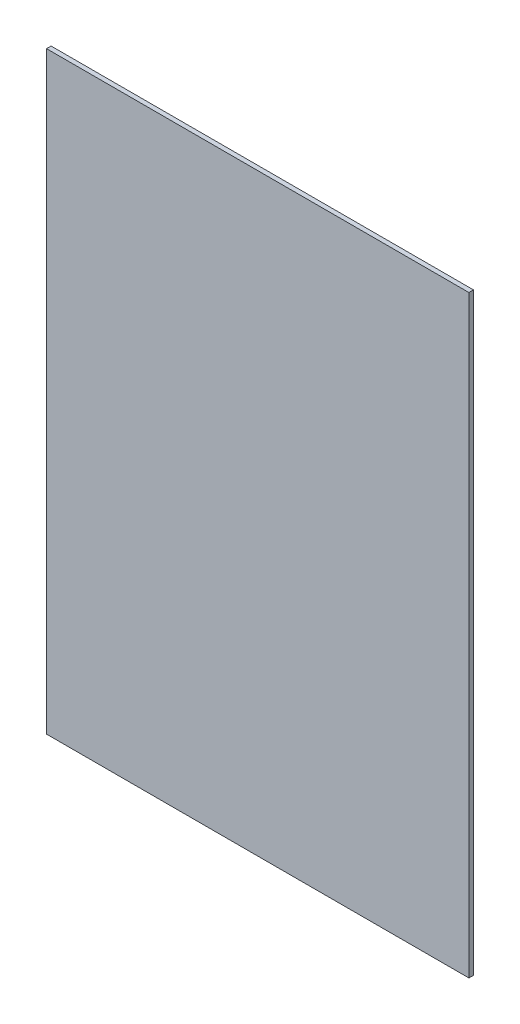
from build123d import *

# Parameters (mm, degrees)
SKETCH1_W           = 370
SKETCH1_H           = 520
BOSS_EXTRUDE1_DEPTH = 4


with BuildPart() as part:
    # Sketch1 → Boss-Extrude1 (new body)
    with BuildSketch(Plane.XY):
        Rectangle(SKETCH1_W, SKETCH1_H)
    extrude(amount=BOSS_EXTRUDE1_DEPTH)


solid = part.part
